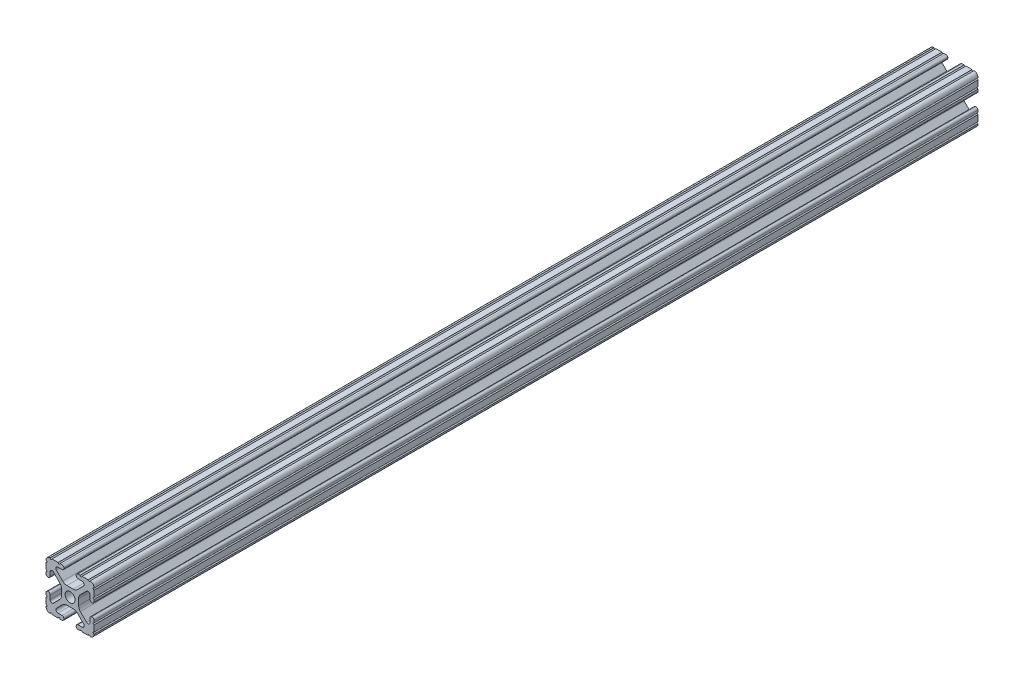
from build123d import *

# Parameters (mm, degrees)
SKETCH1_R      = 2.6035
EXTRUDE1_DEPTH = 466.725


with BuildPart() as part:
    # Sketch1 → Extrude1 (new body)
    with BuildSketch(Plane.XY):
        with BuildLine():
            Line((-7.207036008, 8.724370562), (-3.898272566, 5.423169045))
            ThreePointArc((-3.898272566, 5.423169045), (-2.869120213, 4.736787962), (-1.655778399, 4.4958))
            Line((-1.655778399, 4.4958), (1.655778399, 4.4958))
            ThreePointArc((1.655778399, 4.4958), (2.869120213, 4.736787962), (3.898272566, 5.423169045))
            Line((3.898272566, 5.423169045), (7.207036008, 8.724370562))
            ThreePointArc((7.207036008, 8.724370562), (7.432222385, 9.85140422), (6.476788598, 10.4902))
            Line((6.476788598, 10.4902), (4.287512407, 10.4902))
            ThreePointArc((4.287512407, 10.4902), (3.54574862, 10.79744862), (3.2385, 11.539212407))
            Line((3.2385, 11.539212407), (3.2385, 11.650987593))
            ThreePointArc((3.2385, 11.650987593), (3.54574862, 12.39275138), (4.287512407, 12.7))
            Line((4.287512407, 12.7), (5.317126718, 12.7))
            ThreePointArc((5.317126718, 12.7), (5.825126718, 12.192), (6.333126718, 12.7))
            Line((6.333126718, 12.7), (9.550443118, 12.7))
            ThreePointArc((9.550443118, 12.7), (10.058366869, 12.192000006), (10.566443095, 12.699847501))
            ThreePointArc((10.566443095, 12.699847501), (12.082537762, 12.08250727), (12.699846982, 10.566399977))
            ThreePointArc((12.699846982, 10.566399977), (12.192000006, 10.058323491), (12.7, 9.5504))
            Line((12.7, 9.5504), (12.7, 6.3330836))
            ThreePointArc((12.7, 6.3330836), (12.192, 5.8250836), (12.7, 5.3170836))
            Line((12.7, 5.3170836), (12.7, 4.287469289))
            ThreePointArc((12.7, 4.287469289), (12.39275138, 3.545705502), (11.650987593, 3.238456882))
            Line((11.650987593, 3.238456882), (11.539212407, 3.238456882))
            ThreePointArc((11.539212407, 3.238456882), (10.79744862, 3.545705502), (10.4902, 4.287469289))
            Line((10.4902, 4.287469289), (10.4902, 6.402089023))
            ThreePointArc((10.4902, 6.402089023), (9.856505071, 7.351067942), (8.737131347, 7.129408934))
            Line((8.737131347, 7.129408934), (5.441005833, 3.840816462))
            ThreePointArc((5.441005833, 3.840816462), (4.750877967, 2.809883091), (4.5085, 1.593185507))
            Line((4.5085, 1.593185507), (4.5085, -1.593185507))
            ThreePointArc((4.5085, -1.593185507), (4.750877967, -2.809883091), (5.441005833, -3.840816462))
            Line((5.441005833, -3.840816462), (8.737131347, -7.129408934))
            ThreePointArc((8.737131347, -7.129408934), (9.856505071, -7.351067942), (10.4902, -6.402089023))
            Line((10.4902, -6.402089023), (10.4902, -4.287469289))
            ThreePointArc((10.4902, -4.287469289), (10.79744862, -3.545705502), (11.539212407, -3.238456882))
            Line((11.539212407, -3.238456882), (11.650987593, -3.238456882))
            ThreePointArc((11.650987593, -3.238456882), (12.39275138, -3.545705502), (12.7, -4.287469289))
            Line((12.7, -4.287469289), (12.7, -5.3170836))
            ThreePointArc((12.7, -5.3170836), (12.192, -5.8250836), (12.7, -6.3330836))
            Line((12.7, -6.3330836), (12.7, -9.5504))
            ThreePointArc((12.7, -9.5504), (12.192000006, -10.058323491), (12.699846982, -10.566399977))
            ThreePointArc((12.699846982, -10.566399977), (12.082537762, -12.08250727), (10.566443095, -12.699847501))
            ThreePointArc((10.566443095, -12.699847501), (10.058366869, -12.192000006), (9.550443118, -12.7))
            Line((9.550443118, -12.7), (6.333126718, -12.7))
            ThreePointArc((6.333126718, -12.7), (5.825126718, -12.192), (5.317126718, -12.7))
            Line((5.317126718, -12.7), (4.287512407, -12.7))
            ThreePointArc((4.287512407, -12.7), (3.54574862, -12.39275138), (3.2385, -11.650987593))
            Line((3.2385, -11.650987593), (3.2385, -11.539212407))
            ThreePointArc((3.2385, -11.539212407), (3.54574862, -10.79744862), (4.287512407, -10.4902))
            Line((4.287512407, -10.4902), (6.416408329, -10.4902))
            ThreePointArc((6.416408329, -10.4902), (7.41473083, -9.822813117), (7.179650497, -8.645192506))
            Line((7.179650497, -8.645192506), (3.952270251, -5.423690499))
            ThreePointArc((3.952270251, -5.423690499), (2.922936451, -4.736929036), (1.709253557, -4.4958))
            Line((1.709253557, -4.4958), (-1.709253557, -4.4958))
            ThreePointArc((-1.709253557, -4.4958), (-2.922936451, -4.736929036), (-3.952270251, -5.423690499))
            Line((-3.952270251, -5.423690499), (-7.179650497, -8.645192506))
            ThreePointArc((-7.179650497, -8.645192506), (-7.41473083, -9.822813117), (-6.416408329, -10.4902))
            Line((-6.416408329, -10.4902), (-4.287512407, -10.4902))
            ThreePointArc((-4.287512407, -10.4902), (-3.54574862, -10.79744862), (-3.2385, -11.539212407))
            Line((-3.2385, -11.539212407), (-3.2385, -11.650987593))
            ThreePointArc((-3.2385, -11.650987593), (-3.54574862, -12.39275138), (-4.287512407, -12.7))
            Line((-4.287512407, -12.7), (-5.317126718, -12.7))
            ThreePointArc((-5.317126718, -12.7), (-5.825126718, -12.192), (-6.333126718, -12.7))
            Line((-6.333126718, -12.7), (-9.550443118, -12.7))
            ThreePointArc((-9.550443118, -12.7), (-10.058366869, -12.192000006), (-10.566443095, -12.699847501))
            ThreePointArc((-10.566443095, -12.699847501), (-12.082537762, -12.08250727), (-12.699846982, -10.566399977))
            ThreePointArc((-12.699846982, -10.566399977), (-12.192000006, -10.058323491), (-12.7, -9.5504))
            Line((-12.7, -9.5504), (-12.7, -6.3330836))
            ThreePointArc((-12.7, -6.3330836), (-12.192, -5.8250836), (-12.7, -5.3170836))
            Line((-12.7, -5.3170836), (-12.7, -4.287469289))
            ThreePointArc((-12.7, -4.287469289), (-12.39275138, -3.545705502), (-11.650987593, -3.238456882))
            Line((-11.650987593, -3.238456882), (-11.539212407, -3.238456882))
            ThreePointArc((-11.539212407, -3.238456882), (-10.79744862, -3.545705502), (-10.4902, -4.287469289))
            Line((-10.4902, -4.287469289), (-10.4902, -6.402089023))
            ThreePointArc((-10.4902, -6.402089023), (-9.856505071, -7.351067942), (-8.737131347, -7.129408934))
            Line((-8.737131347, -7.129408934), (-5.441005833, -3.840816462))
            ThreePointArc((-5.441005833, -3.840816462), (-4.750877967, -2.809883091), (-4.5085, -1.593185507))
            Line((-4.5085, -1.593185507), (-4.5085, 1.593185507))
            ThreePointArc((-4.5085, 1.593185507), (-4.750877967, 2.809883091), (-5.441005833, 3.840816462))
            Line((-5.441005833, 3.840816462), (-8.737131347, 7.129408934))
            ThreePointArc((-8.737131347, 7.129408934), (-9.856505071, 7.351067942), (-10.4902, 6.402089023))
            Line((-10.4902, 6.402089023), (-10.4902, 4.287469289))
            ThreePointArc((-10.4902, 4.287469289), (-10.79744862, 3.545705502), (-11.539212407, 3.238456882))
            Line((-11.539212407, 3.238456882), (-11.650987593, 3.238456882))
            ThreePointArc((-11.650987593, 3.238456882), (-12.39275138, 3.545705502), (-12.7, 4.287469289))
            Line((-12.7, 4.287469289), (-12.7, 5.3170836))
            ThreePointArc((-12.7, 5.3170836), (-12.192, 5.8250836), (-12.7, 6.3330836))
            Line((-12.7, 6.3330836), (-12.7, 9.5504))
            ThreePointArc((-12.7, 9.5504), (-12.192000006, 10.058323491), (-12.699846982, 10.566399977))
            ThreePointArc((-12.699846982, 10.566399977), (-12.082537762, 12.08250727), (-10.566443095, 12.699847501))
            ThreePointArc((-10.566443095, 12.699847501), (-10.058366869, 12.192000006), (-9.550443118, 12.7))
            Line((-9.550443118, 12.7), (-6.333126718, 12.7))
            ThreePointArc((-6.333126718, 12.7), (-5.825126718, 12.192), (-5.317126718, 12.7))
            Line((-5.317126718, 12.7), (-4.287512407, 12.7))
            ThreePointArc((-4.287512407, 12.7), (-3.54574862, 12.39275138), (-3.2385, 11.650987593))
            Line((-3.2385, 11.650987593), (-3.2385, 11.539212407))
            ThreePointArc((-3.2385, 11.539212407), (-3.54574862, 10.79744862), (-4.287512407, 10.4902))
            Line((-4.287512407, 10.4902), (-6.476788598, 10.4902))
            ThreePointArc((-6.476788598, 10.4902), (-7.432222385, 9.85140422), (-7.207036008, 8.724370562))
        make_face()
        Circle(SKETCH1_R, mode=Mode.SUBTRACT)
    extrude(amount=-EXTRUDE1_DEPTH)


solid = part.part
